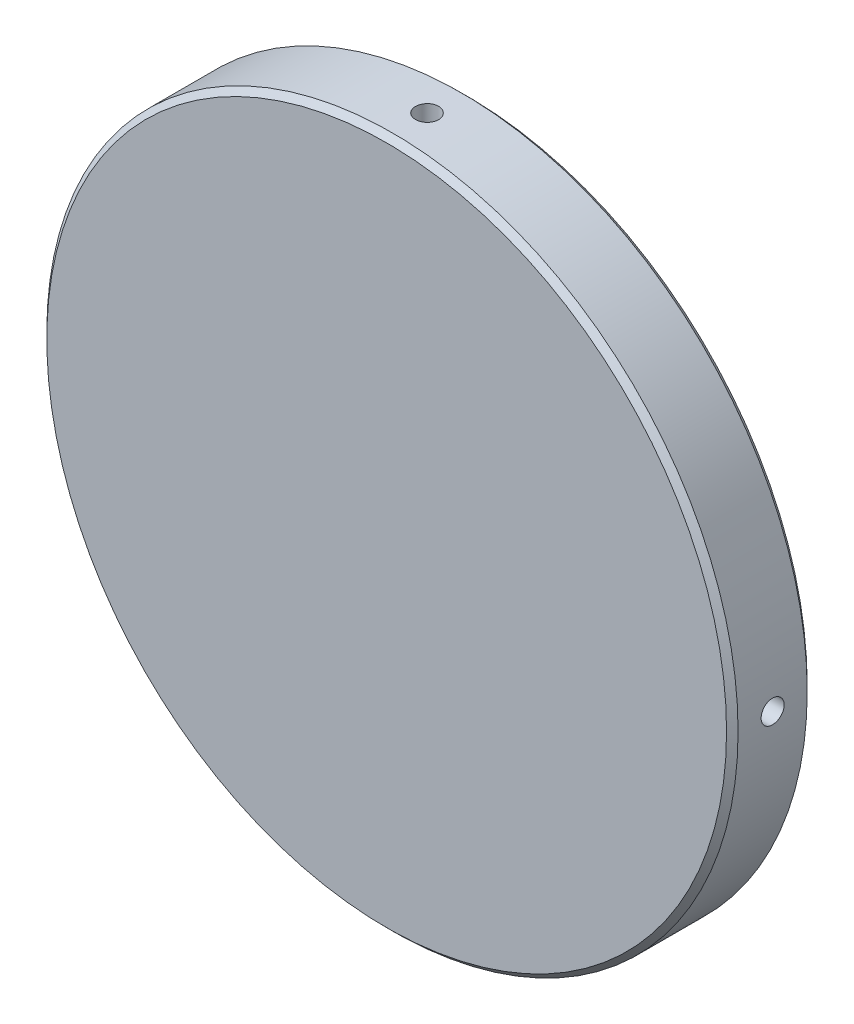
from build123d import *

# Parameters (mm, degrees)
SKETCH1_R           = 60
BOSS_EXTRUDE1_DEPTH = 7
CHAMFER1_SIZE       = 1
CUT_EXTRUDE1_START  = 55
SKETCH2_R           = 2
CUT_EXTRUDE1_DEPTH  = 10
CUT_EXTRUDE2_START  = -65
SKETCH2_2_R         = 2
CUT_EXTRUDE2_DEPTH  = 10
CUT_EXTRUDE3_START  = 55
SKETCH3_R           = 2
CUT_EXTRUDE3_DEPTH  = 10
CUT_EXTRUDE4_START  = -65
SKETCH3_2_R         = 2
CUT_EXTRUDE4_DEPTH  = 10


with BuildPart() as part:
    # Sketch1 → Boss-Extrude1 (new, symmetric)
    with BuildSketch(Plane.XY):
        Circle(SKETCH1_R)
    extrude(amount=BOSS_EXTRUDE1_DEPTH, both=True)

    # Chamfer1
    chamfer1_edges = [part.edges().sort_by_distance(p)[0] for p in [
        (-60, 0, -7),
        (-60, 0, 7),
    ]]
    chamfer(chamfer1_edges, length=CHAMFER1_SIZE)

    # Sketch2 → Cut-Extrude1 (cut)
    with BuildSketch(Plane(origin=(0, 0, 0), x_dir=(1, 0, 0), z_dir=(0, 1, 0)).offset(CUT_EXTRUDE1_START)):
        Circle(SKETCH2_R)
    extrude(amount=CUT_EXTRUDE1_DEPTH, mode=Mode.SUBTRACT)

    # Sketch2<2> → Cut-Extrude2 (cut)
    with BuildSketch(Plane(origin=(0, 0, 0), x_dir=(1, 0, 0), z_dir=(0, 1, 0)).offset(CUT_EXTRUDE2_START)):
        Circle(SKETCH2_2_R)
    extrude(amount=CUT_EXTRUDE2_DEPTH, mode=Mode.SUBTRACT)

    # Sketch3 → Cut-Extrude3 (cut)
    with BuildSketch(Plane(origin=(0, 0, 0), x_dir=(0, 0, -1), z_dir=(1, 0, 0)).offset(CUT_EXTRUDE3_START)):
        Circle(SKETCH3_R)
    extrude(amount=CUT_EXTRUDE3_DEPTH, mode=Mode.SUBTRACT)

    # Sketch3<2> → Cut-Extrude4 (cut)
    with BuildSketch(Plane(origin=(0, 0, 0), x_dir=(0, 0, -1), z_dir=(1, 0, 0)).offset(CUT_EXTRUDE4_START)):
        Circle(SKETCH3_2_R)
    extrude(amount=CUT_EXTRUDE4_DEPTH, mode=Mode.SUBTRACT)


solid = part.part
